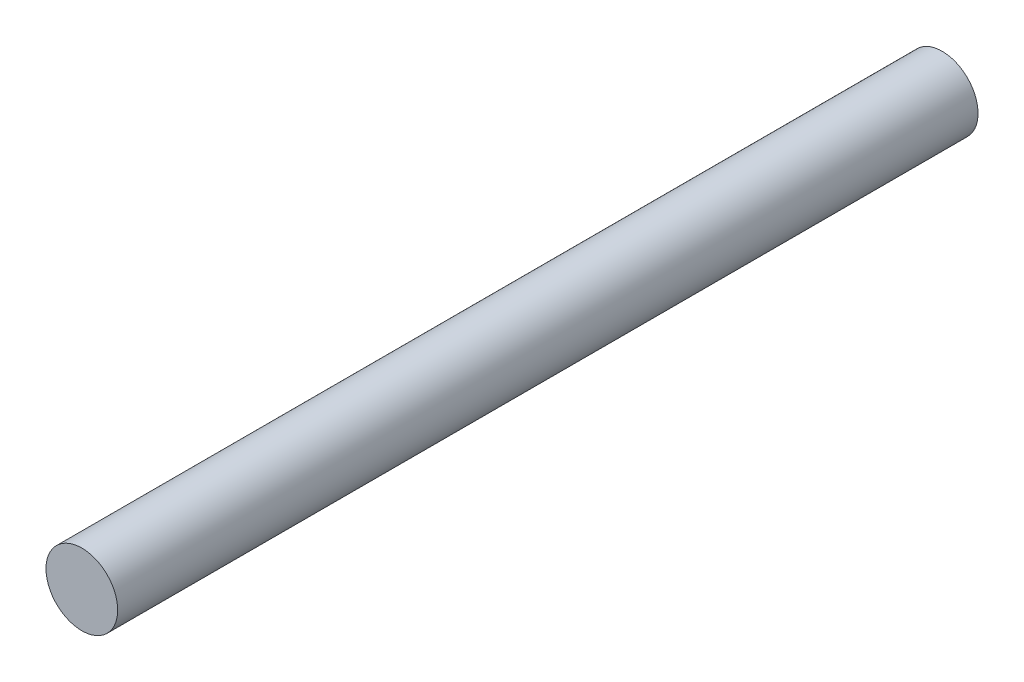
from build123d import *

# Parameters (mm, degrees)
ESQUISSE1_R        = 12.7
BOSS_EXTRU_1_DEPTH = 152.4


with BuildPart() as part:
    # Esquisse1 → Boss.-Extru.1 (new, symmetric)
    with BuildSketch(Plane.XY):
        with Locations(Location((0, 0, 0), (0, 0, 180))):
            Circle(ESQUISSE1_R)
    extrude(amount=BOSS_EXTRU_1_DEPTH, both=True)


solid = part.part
